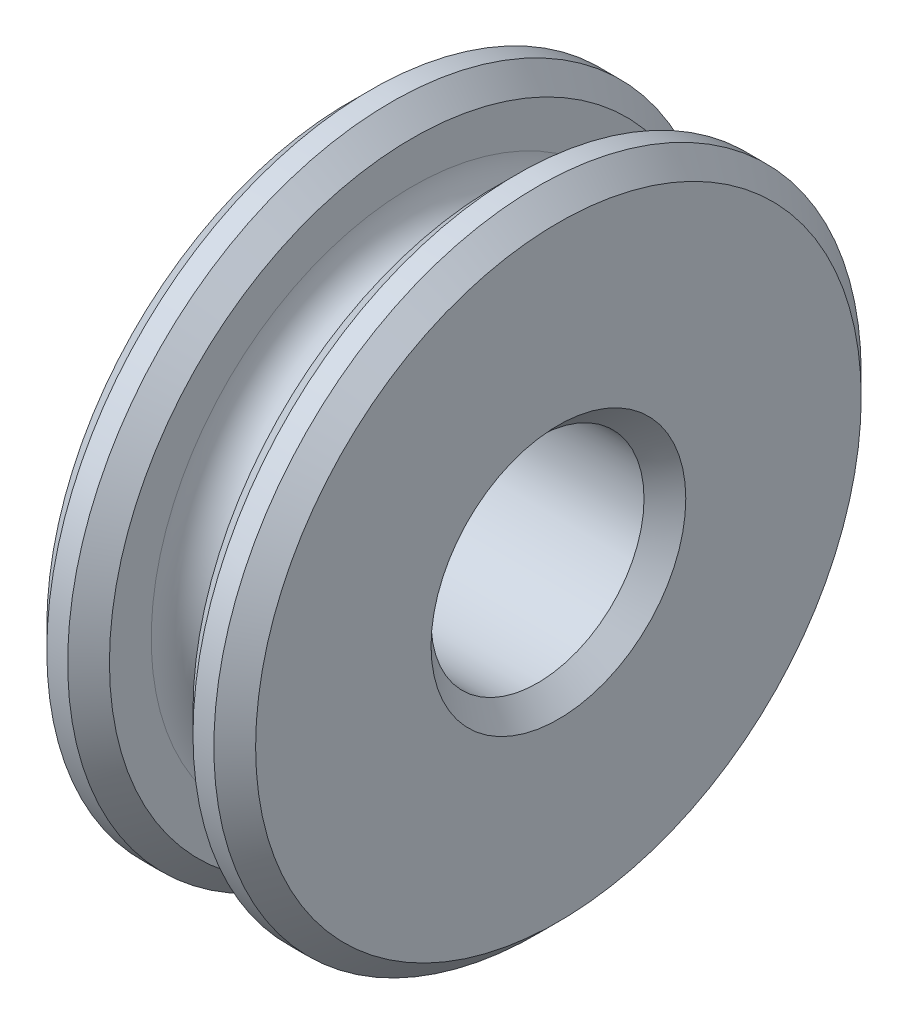
from build123d import *

# Parameters (mm, degrees)
CHANFREIN1_SIZE = 1


with BuildPart() as part:
    # Esquisse1 → Révolution1 (revolve)
    with BuildSketch(Plane(origin=(0, 0, 0), x_dir=(0, 1, 0), z_dir=(0, 0, 1)), mode=Mode.PRIVATE) as r_volution1_sk:
        with BuildLine():
            Line((5.1, 10), (5.1, 0))
            Line((5.1, 0), (15.5, 0))
            Line((15.5, 0), (15.5, 3))
            Line((15.5, 3), (12.5, 3))
            ThreePointArc((12.5, 3), (10.5, 5), (12.5, 7))
            Line((12.5, 7), (15.5, 7))
            Line((15.5, 7), (15.5, 10))
            Line((15.5, 10), (5.1, 10))
        make_face()
    revolve(r_volution1_sk.sketch.rotate(Axis((0, 0, 0), (-1, 0, 0)), 90), axis=Axis((0, 0, 0), (-1, 0, 0)))

    # Chanfrein1
    chanfrein1_edges = [part.edges().sort_by_distance(p)[0] for p in [
        (-10, 0, 15.5),
        (-7, 0, 15.5),
        (-3, 0, 15.5),
        (0, 0, 15.5),
        (0, 0, 5.1),
        (-10, 0, 5.1),
    ]]
    chamfer(chanfrein1_edges, length=CHANFREIN1_SIZE)


solid = part.part
